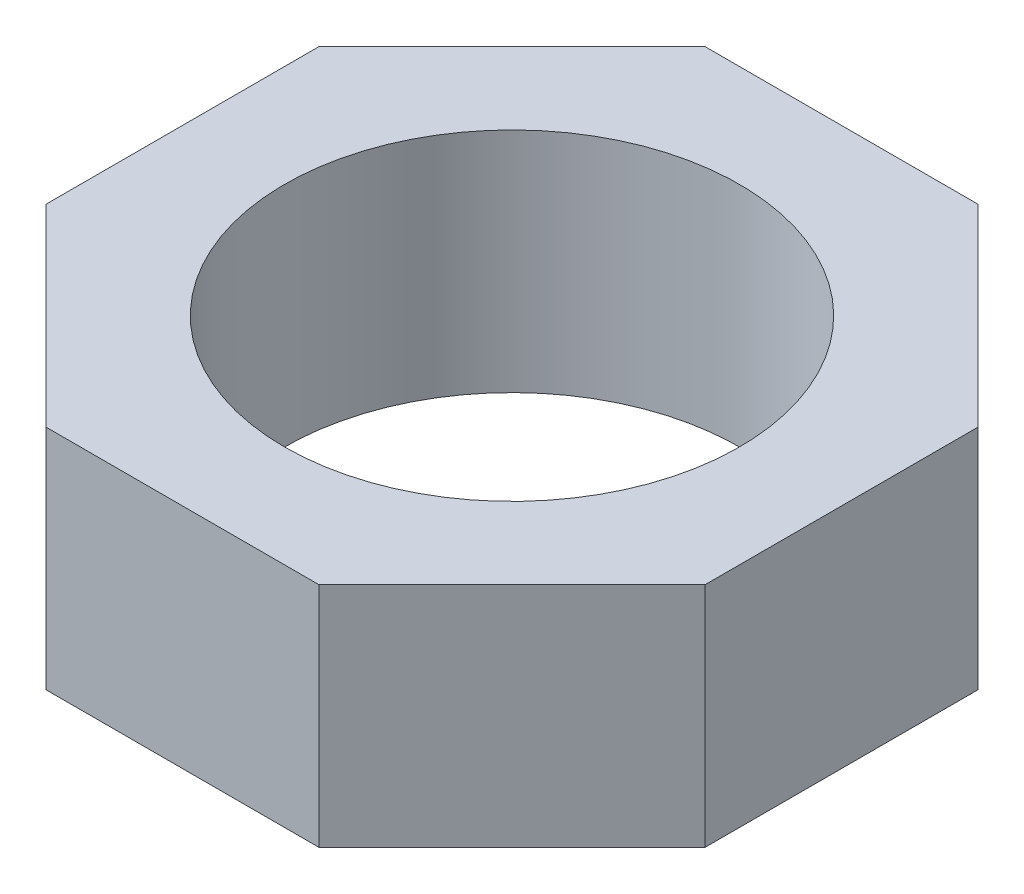
from build123d import *

# Parameters (mm, degrees)
ESBO_O1_R                = 5
RESSALTO_EXTRUS_O1_DEPTH = 5


with BuildPart() as part:
    # Esboço1 → Ressalto-extrusão1 (new body)
    with BuildSketch(Plane(origin=(0, 0, 0), x_dir=(1, 0, 0), z_dir=(0, 1, 0))):
        Polygon((-3, 7.242640687), (3, 7.242640687), (7.242640687, 3), (7.242640687, -3), (3, -7.242640687), (-3, -7.242640687), (-7.242640687, -3), (-7.242640687, 3), align=None)
        with Locations(Location((0, 0, 0), (0, 0, 270))):
            Circle(ESBO_O1_R, mode=Mode.SUBTRACT)
    extrude(amount=RESSALTO_EXTRUS_O1_DEPTH)


solid = part.part
